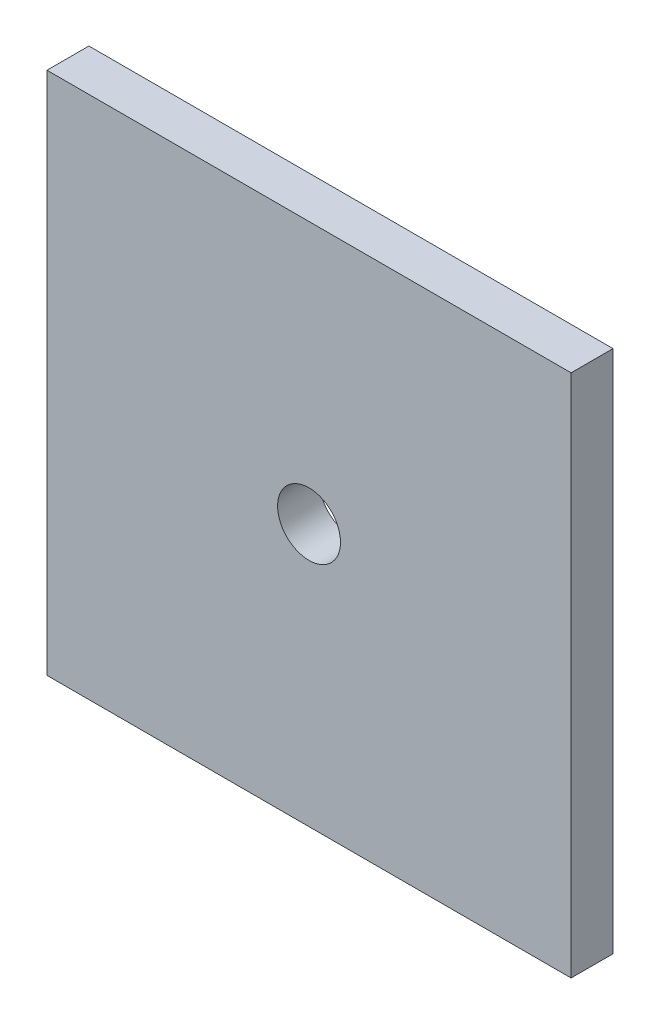
from build123d import *

# Parameters (mm, degrees)
SKETCH1_W           = 37.5
SKETCH1_H           = 37.5
SKETCH1_R           = 2.25
BOSS_EXTRUDE1_DEPTH = 3


with BuildPart() as part:
    # Sketch1 → Boss-Extrude1 (new body)
    with BuildSketch(Plane.XY):
        Rectangle(SKETCH1_W, SKETCH1_H)
        Circle(SKETCH1_R, mode=Mode.SUBTRACT)
    extrude(amount=BOSS_EXTRUDE1_DEPTH)


solid = part.part
